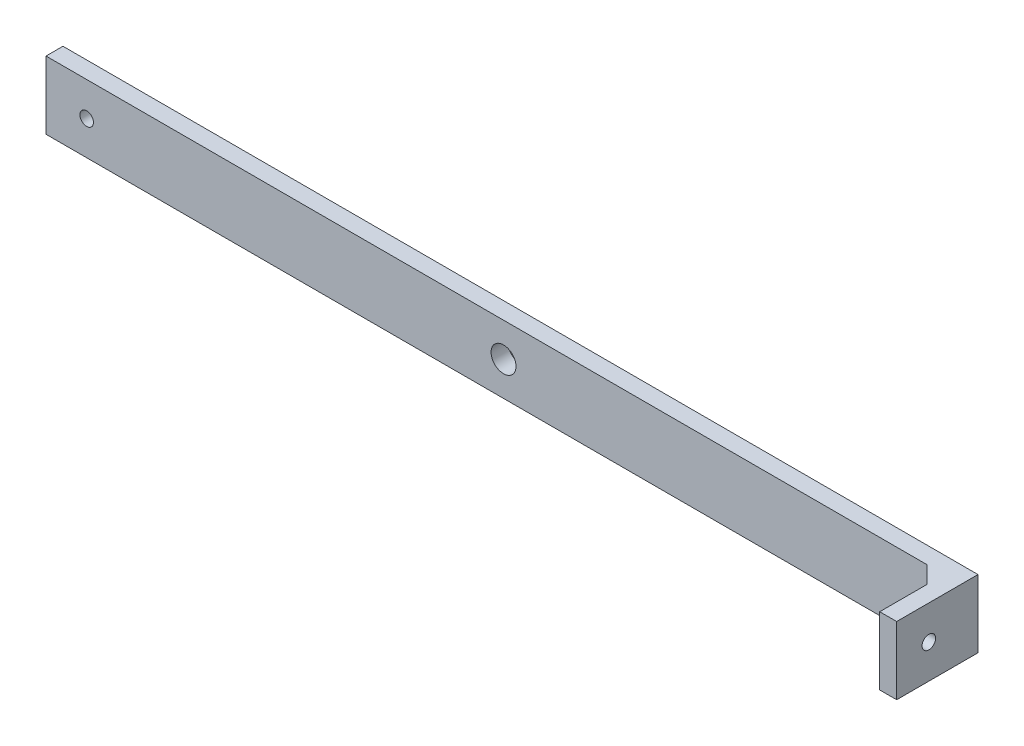
from build123d import *

# Parameters (mm, degrees)
SKETCH1_W           = 270
SKETCH1_H           = 20
BOSS_EXTRUDE1_DEPTH = 5
SKETCH2_W           = 5
SKETCH2_H           = 20
BOSS_EXTRUDE2_DEPTH = 19
SKETCH3_R           = 2
CUT_EXTRUDE1_DEPTH  = 272.248963132
SKETCH4_W           = 5
SKETCH4_H           = 5
BOSS_EXTRUDE3_DEPTH = 5
CUT_EXTRUDE2_DEPTH  = 139.567672998
SKETCH6_R           = 2
CUT_EXTRUDE3_DEPTH  = 138.480907765
SKETCH7_R           = 3.68294157
CUT_EXTRUDE4_DEPTH  = 10


with BuildPart() as part:
    # Sketch1 → Boss-Extrude1 (new body)
    with BuildSketch(Plane.XY):
        Rectangle(SKETCH1_W, SKETCH1_H)
    extrude(amount=BOSS_EXTRUDE1_DEPTH)

    # Sketch2 → Boss-Extrude2 (add)
    with BuildSketch(Plane.XY.offset(5)):
        with Locations((132.5, 0)):
            Rectangle(SKETCH2_W, SKETCH2_H)
    extrude(amount=BOSS_EXTRUDE2_DEPTH)

    # Sketch3 → Cut-Extrude1 (cut, through all)
    with BuildSketch(Plane(origin=(135, 0, 0), x_dir=(0, 0, -1), z_dir=(1, 0, 0))):
        with Locations((-14.5, 0)):
            Circle(SKETCH3_R)
    extrude(amount=-CUT_EXTRUDE1_DEPTH, mode=Mode.SUBTRACT)

    # Sketch4 → Boss-Extrude3 (add)
    with BuildSketch(Plane.ZY.offset(-130)):
        with Locations((7.5, -7.5)):
            Rectangle(SKETCH4_W, SKETCH4_H)
        with Locations((7.5, 7.5)):
            Rectangle(SKETCH4_W, SKETCH4_H)
    extrude(amount=BOSS_EXTRUDE3_DEPTH)

    # Sketch5 → Cut-Extrude2 (cut, through all)
    with BuildSketch(Plane.XZ.offset(10)):
        Polygon((125, 5), (130, 10), (125, 10), align=None)
    extrude(amount=-CUT_EXTRUDE2_DEPTH, mode=Mode.SUBTRACT)

    # Sketch6 → Cut-Extrude3 (cut, through all)
    with BuildSketch(Plane(origin=(0, 0, 0), x_dir=(-1, 0, 0), z_dir=(0, 0, -1))):
        with Locations((123, 0)):
            Circle(SKETCH6_R)
    extrude(amount=-CUT_EXTRUDE3_DEPTH, mode=Mode.SUBTRACT)

    # Sketch7 → Cut-Extrude4 (cut)
    with BuildSketch(Plane(origin=(0, 0, 0), x_dir=(-1, 0, 0), z_dir=(0, 0, -1))):
        Circle(SKETCH7_R)
    extrude(amount=-CUT_EXTRUDE4_DEPTH, mode=Mode.SUBTRACT)


solid = part.part
